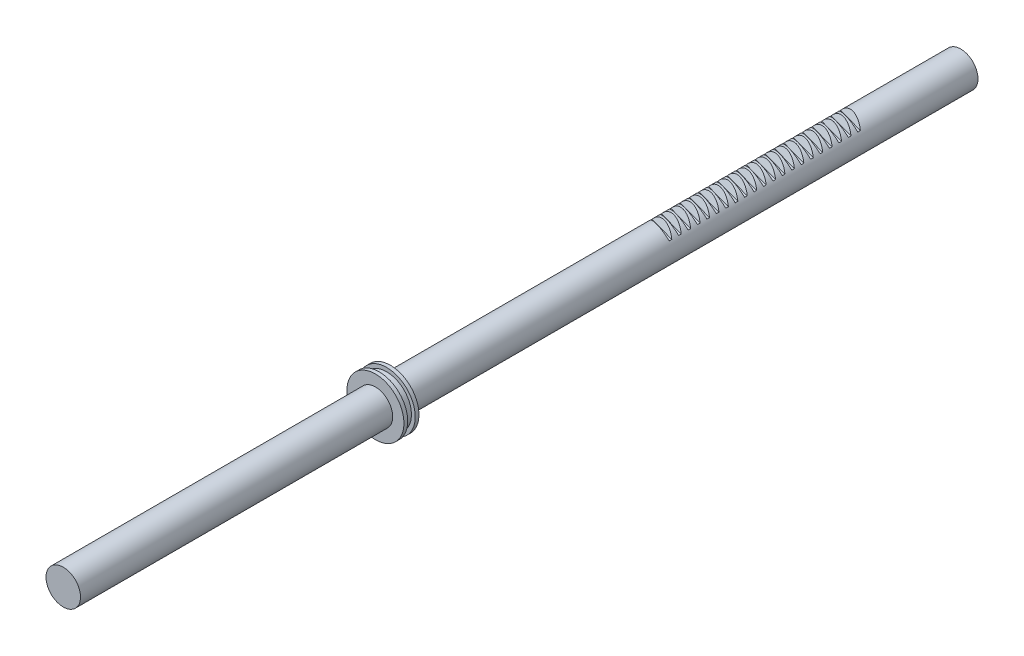
from build123d import *

# Parameters (mm, degrees)
IZIM5_R                     = 11.5
Y_KSEKLIK_EKSTR_ZYON2_DEPTH = 598
IZIM12_R                    = 3.4
KES_EKSTR_ZYON1_DEPTH       = 387


with BuildPart() as part:
    # Çizim5 → Yükseklik-Ekstrüzyon2 (new body)
    with BuildSketch(Plane.XY):
        Circle(IZIM5_R)
    extrude(amount=Y_KSEKLIK_EKSTR_ZYON2_DEPTH)

    # Kes-Süpür2: sweep along a path in Çizim7
    with BuildLine(Plane(origin=(0, 0, 0), x_dir=(1, 0, 0), z_dir=(0, 1, 0))) as kes_s_p_r2_path:
        Line((11.5, -47.002601747), (-17.141789086, -39.043378107))
    # Çizim6 → Kes-Süpür2 (sweep, cut)
    with BuildSketch(Plane(origin=(11.5, 0, 0), x_dir=(0, 0, -1), z_dir=(1, 0, 0))):
        Polygon((-78.362133946, 7), (-80, 11.5), (-81.283711713, 11.5), (-82.921577767, 7), (-84.645319246, 7), (-86.2831853, 11.5), (-87.566897013, 11.5), (-89.204763067, 7), (-90.928504546, 7), (-92.5663706, 11.5), (-93.850082313, 11.5), (-95.487948367, 7), (-97.211689846, 7), (-98.8495559, 11.5), (-100.133267613, 11.5), (-101.771133667, 7), (-103.494875146, 7), (-105.1327412, 11.5), (-106.416452913, 11.5), (-108.054318967, 7), (-109.778060446, 7), (-111.4159265, 11.5), (-112.699638213, 11.5), (-114.337504267, 7), (-116.061245746, 7), (-117.6991118, 11.5), (-118.982823513, 11.5), (-120.620689567, 7), (-122.344431046, 7), (-123.9822971, 11.5), (-125.266008813, 11.5), (-126.903874867, 7), (-128.627616346, 7), (-130.2654824, 11.5), (-131.549194113, 11.5), (-133.187060167, 7), (-134.910801646, 7), (-136.5486677, 11.5), (-137.832379413, 11.5), (-139.470245467, 7), (-141.193986946, 7), (-142.831853, 11.5), (-144.115564713, 11.5), (-145.753430767, 7), (-147.477172246, 7), (-149.1150383, 11.5), (-150.398750013, 11.5), (-152.036616067, 7), (-153.760357546, 7), (-155.3982236, 11.5), (-156.681935313, 11.5), (-158.319801367, 7), (-160.043542846, 7), (-161.6814089, 11.5), (-162.965120613, 11.5), (-164.602986667, 7), (-166.326728146, 7), (-167.9645942, 11.5), (-169.248305913, 11.5), (-170.886171967, 7), (-172.609913446, 7), (-174.2477795, 11.5), (-175.531491213, 11.5), (-177.169357267, 7), (-178.893098746, 7), (-180.5309648, 11.5), (-181.814676513, 11.5), (-183.452542567, 7), (-185.176284046, 7), (-186.8141501, 11.5), (-188.097861813, 11.5), (-189.735727867, 7), (-191.459469346, 7), (-193.0973354, 11.5), (-194.381047113, 11.5), (-196.018913167, 7), (-197.742654646, 7), (-199.3805207, 11.5), (-200.664232413, 11.5), (-202.302098467, 7), (-204.022098467, 7), (-206.232393599, 13.072735964), (-74.431838814, 13.072735964), (-76.642133946, 7), align=None)
    sweep(path=kes_s_p_r2_path.line, mode=Mode.SUBTRACT)

    # Çizim11 → Döndür1 (revolve)
    with BuildSketch(Plane(origin=(0, 0, 0), x_dir=(0, 0, -1), z_dir=(1, 0, 0)), mode=Mode.PRIVATE) as d_nd_r1_sk:
        Polygon((-380, 19), (-380, 11.5), (-390, 11.5), (-390, 19), (-387.5, 19), (-387.5, 16.5), (-382.5, 16.5), (-382.5, 19), align=None)
    revolve(d_nd_r1_sk.sketch.rotate(Axis((0, 0, 0), (0, 0, 1)), 90), axis=Axis((0, 0, 0), (0, 0, 1)))

    # Çizim12 → Kes-Ekstrüzyon1 (cut)
    with BuildSketch(Plane(origin=(0, 0, 0), x_dir=(-1, 0, 0), z_dir=(0, 0, -1))):
        with Locations((0, -3.4)):
            Circle(IZIM12_R)
    extrude(amount=-KES_EKSTR_ZYON1_DEPTH, mode=Mode.SUBTRACT)


solid = part.part
